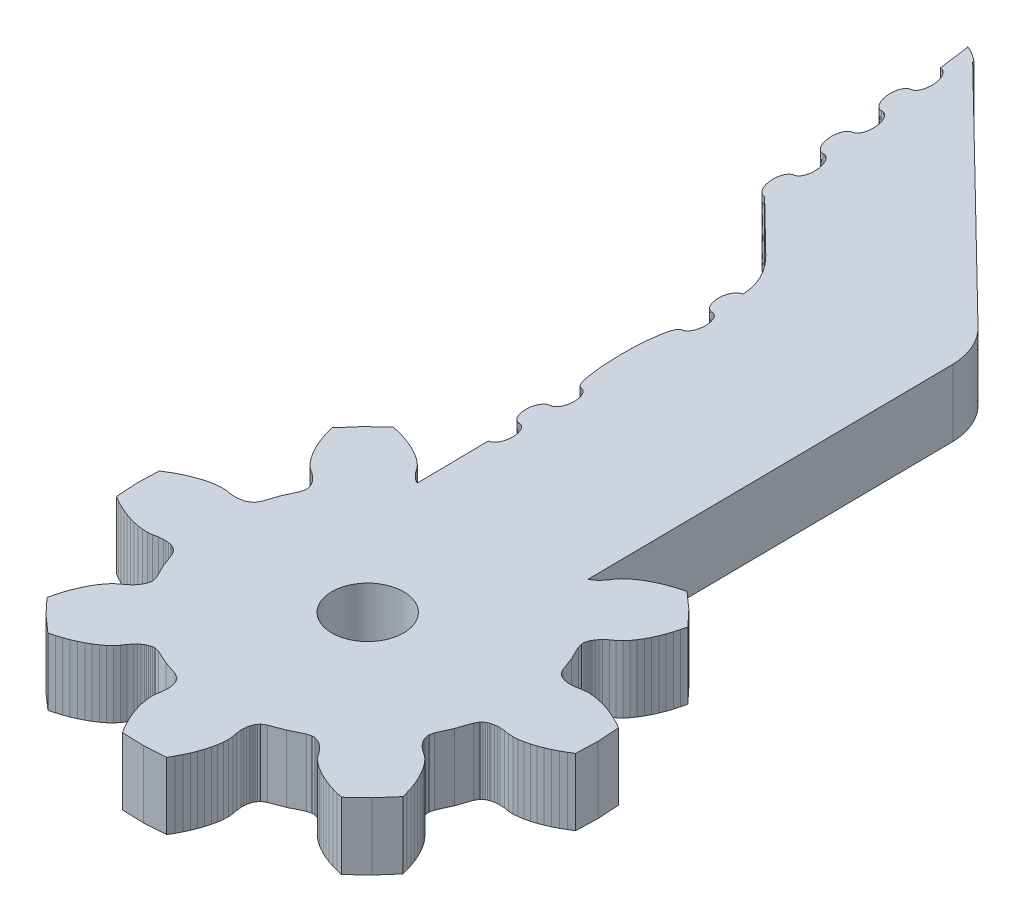
from build123d import *

# Parameters (mm, degrees)
SKETCH1_R           = 1.7
BOSS_EXTRUDE1_DEPTH = 3.175


with BuildPart() as part:
    # Sketch1 → Boss-Extrude1 (new body)
    with BuildSketch(Plane(origin=(0, 0, 0), x_dir=(1, 0, 0), z_dir=(0, 1, 0))):
        with BuildLine():
            Line((-18.239776135, 12.660233322), (-18.20571439, 12.693829395))
            Line((-18.20571439, 12.693829395), (-18.249739244, 16.070576596))
            add(Edge.make_bspline(
                [(-18.249739244, 16.070576596), (-18.022108524, 16.07365298), (-17.837527794, 16.403148424), (-17.837527794, 16.805920419)],
                knots=[2, 2, 2, 2, 3, 3, 3, 3], degree=3))
            add(Edge.make_bspline(
                [(-17.837527794, 16.805920419), (-17.837527794, 17.209024469), (-18.022108524, 17.533080083), (-18.249739243, 17.529818139)],
                knots=[3, 3, 3, 3, 4, 4, 4, 4], degree=3))
            add(Edge.make_bspline(
                [(-18.249739243, 17.529818139), (-18.477564936, 17.526741754), (-18.662067677, 17.850797368), (-18.662067677, 18.253706092)],
                knots=[4, 4, 4, 4, 5, 5, 5, 5], degree=3))
            add(Edge.make_bspline(
                [(-18.662067677, 18.253706092), (-18.662067677, 18.656673414), (-18.477564936, 18.985983297), (-18.249739243, 18.989245242)],
                knots=[5, 5, 5, 5, 6, 6, 6, 6], degree=3))
            add(Edge.make_bspline(
                [(-18.249739243, 18.989245242), (-18.022108524, 18.992507186), (-17.837527794, 19.321621744), (-17.837527794, 19.724784391)],
                knots=[6, 6, 6, 6, 7, 7, 7, 7], degree=3))
            add(Edge.make_bspline(
                [(-17.837527794, 19.724784391), (-17.837527794, 20.127566153), (-18.022108524, 20.451748729), (-18.249739243, 20.448672345)],
                knots=[7, 7, 7, 7, 8, 8, 8, 8], degree=3))
            add(Edge.make_bspline(
                [(-18.249739243, 20.448672345), (-18.477564936, 20.438300533), (-18.662067677, 21.495336527), (-18.662067677, 22.80941178)],
                knots=[8, 8, 8, 8, 9, 9, 9, 9], degree=3))
            add(Edge.make_bspline(
                [(-18.662067677, 22.80941178), (-18.662067677, 24.12368236), (-18.477564936, 25.197418727), (-18.249739243, 25.2079175)],
                knots=[9, 9, 9, 9, 10, 10, 10, 10], degree=3))
            add(Edge.make_bspline(
                [(-18.249739243, 25.2079175), (-18.022303496, 25.211179444), (-17.837722766, 25.540284235), (-17.837722766, 25.943446883)],
                knots=[10, 10, 10, 10, 11, 11, 11, 11], degree=3))
            add(Edge.make_bspline(
                [(-17.837722766, 25.943446883), (-17.837722766, 26.346423971), (-18.022303496, 26.670411221), (-18.249934216, 26.667149276)],
                knots=[11, 11, 11, 11, 12, 12, 12, 12], degree=3))
            add(Edge.make_bspline(
                [(-18.249934216, 26.667149276), (-18.477564936, 26.664082658), (-18.662067676, 26.988128506), (-18.662067676, 27.391105594)],
                knots=[12, 12, 12, 12, 13, 13, 13, 13], degree=3))
            add(Edge.make_bspline(
                [(-18.662067676, 27.391105594), (-18.662067676, 27.794004551), (-18.477564935, 28.123324201), (-18.249934216, 28.126390819)],
                knots=[13, 13, 13, 13, 14, 14, 14, 14], degree=3))
            add(Edge.make_bspline(
                [(-18.249934216, 28.126390819), (-18.259897325, 28.922148977), (-18.698488591, 29.681244444), (-19.266970724, 30.237005535)],
                knots=[14, 14, 14, 14, 15, 15, 15, 15], degree=3))
            Line((-19.266970724, 30.237005535), (-21.741565237, 32.654887595))
            add(Edge.make_bspline(
                [(-21.741565237, 32.654887595), (-21.968123606, 32.631663332), (-22.19300521, 32.964811372), (-22.244127073, 33.399138284)],
                knots=[16, 16, 16, 16, 17, 17, 17, 17], degree=3))
            add(Edge.make_bspline(
                [(-22.244127073, 33.399138284), (-22.295170946, 33.833465196), (-22.15282132, 34.20411583), (-21.926282448, 34.227359625)],
                knots=[17, 17, 17, 17, 18, 18, 18, 18], degree=3))
            add(Edge.make_bspline(
                [(-21.926282448, 34.227359625), (-21.699724078, 34.250779213), (-21.557374452, 34.621625173), (-21.608437823, 35.055756759)],
                knots=[18, 18, 18, 18, 19, 19, 19, 19], degree=3))
            add(Edge.make_bspline(
                [(-21.608437823, 35.055756759), (-21.659540189, 35.490103204), (-21.884421792, 35.823231711), (-22.110980162, 35.800007448)],
                knots=[19, 19, 19, 19, 20, 20, 20, 20], degree=3))
            add(Edge.make_bspline(
                [(-22.110980162, 35.800007448), (-22.33740205, 35.776958979), (-22.562478626, 36.110048421), (-22.613405516, 36.544375334)],
                knots=[20, 20, 20, 20, 21, 21, 21, 21], degree=3))
            add(Edge.make_bspline(
                [(-22.613405516, 36.544375334), (-22.66444939, 36.97858505), (-22.522294736, 37.349548205), (-22.295560891, 37.372792)],
                knots=[21, 21, 21, 21, 22, 22, 22, 22], degree=3))
            add(Edge.make_bspline(
                [(-22.295560891, 37.372792), (-22.069197495, 37.396016263), (-21.926789377, 37.766862222), (-21.977891742, 38.201013341)],
                knots=[22, 22, 22, 22, 23, 23, 23, 23], degree=3))
            add(Edge.make_bspline(
                [(-21.977891742, 38.201013341), (-22.028955113, 38.635398851), (-22.253895209, 38.968664086), (-22.480453578, 38.945244498)],
                knots=[23, 23, 23, 23, 24, 24, 24, 24], degree=3))
            add(Edge.make_bspline(
                [(-22.480453578, 38.945244498), (-22.706797477, 38.922215561), (-22.931952043, 39.255344069), (-22.982800943, 39.689690513)],
                knots=[24, 24, 24, 24, 25, 25, 25, 25], degree=3))
            add(Edge.make_bspline(
                [(-22.982800943, 39.689690513), (-23.033922806, 40.124017425), (-22.891690164, 40.494668059), (-22.664956319, 40.517892321)],
                knots=[25, 25, 25, 25, 26, 26, 26, 26], degree=3))
            add(Edge.make_bspline(
                [(-22.664956319, 40.517892321), (-22.438592922, 40.541331442), (-22.296262793, 40.912177402), (-22.347170186, 41.346308988)],
                knots=[26, 26, 26, 26, 27, 27, 27, 27], degree=3))
            add(Edge.make_bspline(
                [(-22.347170186, 41.346308988), (-22.398409032, 41.7806359), (-22.623173652, 42.113725342), (-22.849907497, 42.090559677)],
                knots=[27, 27, 27, 27, 28, 28, 28, 28], degree=3))
            Line((-22.849907497, 42.090559677), (-23.051996783, 43.595097322))
            Line((-23.051996783, 43.595097322), (-23.077733189, 43.592030703))
            add(Edge.make_bspline(
                [(-23.077733189, 43.592030703), (-23.078630064, 43.658988459), (-22.543819731, 43.375062573), (-22.305835957, 43.142273037)],
                knots=[30, 30, 30, 30, 31, 31, 31, 31], degree=3))
            Line((-22.305835957, 43.142273037), (-22.321102325, 43.099066924))
            Line((-22.321102325, 43.099066924), (-11.306641593, 32.336662461))
            Line((-11.306641593, 32.336662461), (-11.305237789, 32.333205191))
            add(Edge.make_bspline(
                [(-11.305237789, 32.333205191), (-10.733499611, 31.780784174), (-10.404015111, 31.023681033), (-10.389704109, 30.228098669)],
                knots=[34, 34, 34, 34, 35, 35, 35, 35], degree=3))
            Line((-10.389704109, 30.228098669), (-10.207755513, 12.741899125))
            Line((-10.207755513, 12.741899125), (-10.19810436, 12.756431381))
            Line((-10.19810436, 12.756431381), (-10.139846494, 12.787790971))
            Line((-10.139846494, 12.787790971), (-10.034931641, 12.857620019))
            Line((-10.034931641, 12.857620019), (-9.941851636, 12.934363608))
            Line((-9.941851636, 12.934363608), (-9.858032839, 13.016410298))
            Line((-9.858032839, 13.016410298), (-9.71133532, 13.193453792))
            Line((-9.71133532, 13.193453792), (-9.587254643, 13.384697486))
            Line((-9.587254643, 13.384697486), (-9.441843944, 13.562502752))
            Line((-9.441843944, 13.562502752), (-9.267050848, 13.721419992))
            Line((-9.267050848, 13.721419992), (-9.074242266, 13.867992629))
            Line((-9.074242266, 13.867992629), (-8.866147819, 14.003744204))
            Line((-8.866147819, 14.003744204), (-8.644463769, 14.128743084))
            Line((-8.644463769, 14.128743084), (-8.410632915, 14.243760804))
            Line((-8.410632915, 14.243760804), (-8.165415651, 14.348279751))
            Line((-8.165415651, 14.348279751), (-7.909747845, 14.442817539))
            Line((-7.909747845, 14.442817539), (-7.643843969, 14.52660263))
            Line((-7.643843969, 14.52660263), (-7.36879587, 14.600074508))
            Line((-7.36879587, 14.600074508), (-6.594402985, 13.917214783))
            Line((-6.594402985, 13.917214783), (-5.888815995, 13.163373586))
            Line((-5.888815995, 13.163373586), (-5.953273996, 12.885395377))
            Line((-5.953273996, 12.885395377), (-6.028786953, 12.61670492))
            Line((-6.028786953, 12.61670492), (-6.114984419, 12.357614736))
            Line((-6.114984419, 12.357614736), (-6.211710414, 12.108896364))
            Line((-6.211710414, 12.108896364), (-6.318906448, 11.87105765))
            Line((-6.318906448, 11.87105765), (-6.436845483, 11.645309616))
            Line((-6.436845483, 11.645309616), (-6.565586009, 11.432687489))
            Line((-6.565586009, 11.432687489), (-6.70575194, 11.234919906))
            Line((-6.70575194, 11.234919906), (-6.858961549, 11.054936755))
            Line((-6.858961549, 11.054936755), (-7.031590448, 10.903627463))
            Line((-7.031590448, 10.903627463), (-7.218471857, 10.773384081))
            Line((-7.218471857, 10.773384081), (-7.390515837, 10.620980963))
            Line((-7.390515837, 10.620980963), (-7.469986742, 10.534451541))
            Line((-7.469986742, 10.534451541), (-7.543530474, 10.438829694))
            Line((-7.543530474, 10.438829694), (-7.609840717, 10.331625014))
            Line((-7.609840717, 10.331625014), (-7.639496076, 10.272284973))
            Line((-7.639496076, 10.272284973), (-7.665934385, 10.207514868))
            Line((-7.665934385, 10.207514868), (-7.688434244, 10.135634897))
            Line((-7.688434244, 10.135634897), (-7.704519498, 10.052943632))
            Line((-7.704519498, 10.052943632), (-7.709257337, 9.950026358))
            Line((-7.709257337, 9.950026358), (-7.649459185, 9.730362729))
            Line((-7.649459185, 9.730362729), (-7.339082018, 9.096783756))
            Line((-7.339082018, 9.096783756), (-7.090628206, 8.436581847))
            Line((-7.090628206, 8.436581847), (-6.971597324, 8.242457094))
            Line((-6.971597324, 8.242457094), (-6.893393742, 8.175499338))
            Line((-6.893393742, 8.175499338), (-6.822228678, 8.130632954))
            Line((-6.822228678, 8.130632954), (-6.754631615, 8.097798652))
            Line((-6.754631615, 8.097798652), (-6.689471713, 8.072777391))
            Line((-6.689471713, 8.072777391), (-6.625891089, 8.053899132))
            Line((-6.625891089, 8.053899132), (-6.502395331, 8.028868104))
            Line((-6.502395331, 8.028868104), (-6.382487072, 8.017285272))
            Line((-6.382487072, 8.017285272), (-6.265308432, 8.01581056))
            Line((-6.265308432, 8.01581056), (-6.036585864, 8.037257356))
            Line((-6.036585864, 8.037257356), (-5.813809967, 8.084555549))
            Line((-5.813809967, 8.084555549), (-5.585652821, 8.107086404))
            Line((-5.585652821, 8.107086404), (-5.349852741, 8.095816093))
            Line((-5.349852741, 8.095816093), (-5.109880245, 8.062796231))
            Line((-5.109880245, 8.062796231), (-4.867041648, 8.011073904))
            Line((-4.867041648, 8.011073904), (-4.622019357, 7.942719568))
            Line((-4.622019357, 7.942719568), (-4.37567125, 7.858358265))
            Line((-4.37567125, 7.858358265), (-4.128289788, 7.758575973))
            Line((-4.128289788, 7.758575973), (-3.880927823, 7.644271193))
            Line((-3.880927823, 7.644271193), (-3.633741334, 7.515238832))
            Line((-3.633741334, 7.515238832), (-3.387256746, 7.372309026))
            Line((-3.387256746, 7.372309026), (-3.321706898, 6.340880272))
            Line((-3.321706898, 6.340880272), (-3.354988751, 5.307976808))
            Line((-3.354988751, 5.307976808), (-3.596813489, 5.157185129))
            Line((-3.596813489, 5.157185129), (-3.839847059, 5.020593651))
            Line((-3.839847059, 5.020593651), (-4.08358253, 4.898280505))
            Line((-4.08358253, 4.898280505), (-4.327493477, 4.791075825))
            Line((-4.327493477, 4.791075825), (-4.571111964, 4.698911248))
            Line((-4.571111964, 4.698911248), (-4.813950561, 4.622743871))
            Line((-4.813950561, 4.622743871), (-5.054995408, 4.563540558))
            Line((-5.054995408, 4.563540558), (-5.293681084, 4.52296158))
            Line((-5.293681084, 4.52296158), (-5.529110715, 4.504278647))
            Line((-5.529110715, 4.504278647), (-5.758028255, 4.519699636))
            Line((-5.758028255, 4.519699636), (-5.982090973, 4.559956326))
            Line((-5.982090973, 4.559956326), (-6.211320469, 4.574097929))
            Line((-6.211320469, 4.574097929), (-6.328499109, 4.569048752))
            Line((-6.328499109, 4.569048752), (-6.447841948, 4.553617997))
            Line((-6.447841948, 4.553617997), (-6.570499323, 4.524758579))
            Line((-6.570499323, 4.524758579), (-6.633495028, 4.503887995))
            Line((-6.633495028, 4.503887995), (-6.697953029, 4.476884175))
            Line((-6.697953029, 4.476884175), (-6.764399752, 4.441803624))
            Line((-6.764399752, 4.441803624), (-6.834355985, 4.394632393))
            Line((-6.834355985, 4.394632393), (-6.910200396, 4.325379556))
            Line((-6.910200396, 4.325379556), (-7.023031143, 4.127797533))
            Line((-7.023031143, 4.127797533), (-7.250661863, 3.459909546))
            Line((-7.250661863, 3.459909546), (-7.541171304, 2.816925626))
            Line((-7.541171304, 2.816925626), (-7.593872446, 2.5954064))
            Line((-7.593872446, 2.5954064), (-7.585878562, 2.49274305))
            Line((-7.585878562, 2.49274305), (-7.567102684, 2.410559632))
            Line((-7.567102684, 2.410559632), (-7.5426336, 2.339451198))
            Line((-7.5426336, 2.339451198), (-7.514011596, 2.275579593))
            Line((-7.514011596, 2.275579593), (-7.482698968, 2.217138052))
            Line((-7.482698968, 2.217138052), (-7.412937707, 2.112111257))
            Line((-7.412937707, 2.112111257), (-7.336332902, 2.018852854))
            Line((-7.336332902, 2.018852854), (-7.254502827, 1.934813839))
            Line((-7.254502827, 1.934813839), (-7.077584527, 1.787860317))
            Line((-7.077584527, 1.787860317), (-6.886686679, 1.663632976))
            Line((-6.886686679, 1.663632976), (-6.709202958, 1.517695148))
            Line((-6.709202958, 1.517695148), (-6.550768078, 1.342839306))
            Line((-6.550768078, 1.342839306), (-6.404402013, 1.149417726))
            Line((-6.404402013, 1.149417726), (-6.268954423, 0.940956044))
            Line((-6.268954423, 0.940956044), (-6.144171844, 0.719055932))
            Line((-6.144171844, 0.719055932), (-6.029371872, 0.484860048))
            Line((-6.029371872, 0.484860048), (-5.924846965, 0.239208293))
            Line((-5.924846965, 0.239208293), (-5.830675113, -0.017000832))
            Line((-5.830675113, -0.017000832), (-5.746856315, -0.283318078))
            Line((-5.746856315, -0.283318078), (-5.673644036, -0.558923075))
            Line((-5.673644036, -0.558923075), (-6.355132391, -1.334718915))
            Line((-6.355132391, -1.334718915), (-7.107805308, -2.041584207))
            Line((-7.107805308, -2.041584207), (-7.385076097, -1.976941064))
            Line((-7.385076097, -1.976941064), (-7.653475625, -1.901291301))
            Line((-7.653475625, -1.901291301), (-7.912107017, -1.815142765))
            Line((-7.912107017, -1.815142765), (-8.160365857, -1.718046207))
            Line((-8.160365857, -1.718046207), (-8.397589237, -1.610646201))
            Line((-8.397589237, -1.610646201), (-8.623055759, -1.492552096))
            Line((-8.623055759, -1.492552096), (-8.835361618, -1.363588099))
            Line((-8.835361618, -1.363588099), (-9.032713065, -1.223158466))
            Line((-9.032713065, -1.223158466), (-9.212360984, -1.069808016))
            Line((-9.212360984, -1.069808016), (-9.363406396, -0.896739407))
            Line((-9.363406396, -0.896739407), (-9.493277764, -0.709529194))
            Line((-9.493277764, -0.709529194), (-9.645395526, -0.537163758))
            Line((-9.645395526, -0.537163758), (-9.73196344, -0.457666073))
            Line((-9.73196344, -0.457666073), (-9.82722714, -0.383998869))
            Line((-9.82722714, -0.383998869), (-9.934442671, -0.317431765))
            Line((-9.934442671, -0.317431765), (-9.993655905, -0.287673848))
            Line((-9.993655905, -0.287673848), (-10.058308878, -0.261177874))
            Line((-10.058308878, -0.261177874), (-10.130000369, -0.238900943))
            Line((-10.130000369, -0.238900943), (-10.212610336, -0.222708417))
            Line((-10.212610336, -0.222708417), (-10.31514652, -0.2178448))
            Line((-10.31514652, -0.2178448), (-10.534412908, -0.277692688))
            Line((-10.534412908, -0.277692688), (-11.166846111, -0.588876319))
            Line((-11.166846111, -0.588876319), (-11.826049078, -0.837594691))
            Line((-11.826049078, -0.837594691), (-12.019832523, -0.956772855))
            Line((-12.019832523, -0.956772855), (-12.086649694, -1.035176715))
            Line((-12.086649694, -1.035176715), (-12.13137645, -1.106480474))
            Line((-12.13137645, -1.106480474), (-12.164151374, -1.174131637))
            Line((-12.164151374, -1.174131637), (-12.189010404, -1.23948772))
            Line((-12.189010404, -1.23948772), (-12.207981255, -1.303163998))
            Line((-12.207981255, -1.303163998), (-12.232957268, -1.426883492))
            Line((-12.232957268, -1.426883492), (-12.244577646, -1.546960156))
            Line((-12.244577646, -1.546960156), (-12.246000947, -1.66434132))
            Line((-12.246000947, -1.66434132), (-12.224651428, -1.893673587))
            Line((-12.224651428, -1.893673587), (-12.177370529, -2.116667524))
            Line((-12.177370529, -2.116667524), (-12.154753686, -2.345482177))
            Line((-12.154753686, -2.345482177), (-12.166140097, -2.58166062))
            Line((-12.166140097, -2.58166062), (-12.199090496, -2.821862778))
            Line((-12.199090496, -2.821862778), (-12.250524315, -3.065209686))
            Line((-12.250524315, -3.065209686), (-12.319018253, -3.310666114))
            Line((-12.319018253, -3.310666114), (-12.403226996, -3.557401928))
            Line((-12.403226996, -3.557401928), (-12.502624119, -3.805231567))
            Line((-12.502624119, -3.805231567), (-12.616936659, -4.053246767))
            Line((-12.616936659, -4.053246767), (-12.745482213, -4.300754118))
            Line((-12.745482213, -4.300754118), (-12.88839726, -4.547675491))
            Line((-12.88839726, -4.547675491), (-13.91795102, -4.613344095))
            Line((-13.91795102, -4.613344095), (-14.948986574, -4.580128908))
            Line((-14.948986574, -4.580128908), (-15.099447068, -4.337934424))
            Line((-15.099447068, -4.337934424), (-15.235850024, -4.094460554))
            Line((-15.235850024, -4.094460554), (-15.357688514, -3.850224913))
            Line((-15.357688514, -3.850224913), (-15.464904045, -3.605666985))
            Line((-15.464904045, -3.605666985), (-15.556892202, -3.361616903))
            Line((-15.556892202, -3.361616903), (-15.632795105, -3.11852392))
            Line((-15.632795105, -3.11852392), (-15.692027835, -2.87684705))
            Line((-15.692027835, -2.87684705), (-15.732387201, -2.637719184))
            Line((-15.732387201, -2.637719184), (-15.751046096, -2.402058355))
            Line((-15.751046096, -2.402058355), (-15.735838219, -2.172735855))
            Line((-15.735838219, -2.172735855), (-15.695478853, -1.94833557))
            Line((-15.695478853, -1.94833557), (-15.6815383, -1.718427092))
            Line((-15.6815383, -1.718427092), (-15.686588095, -1.601045927))
            Line((-15.686588095, -1.601045927), (-15.701990944, -1.481486878))
            Line((-15.701990944, -1.481486878), (-15.730612948, -1.358656117))
            Line((-15.730612948, -1.358656117), (-15.751631014, -1.29555605))
            Line((-15.751631014, -1.29555605), (-15.778595749, -1.231098468))
            Line((-15.778595749, -1.231098468), (-15.813534871, -1.164345804))
            Line((-15.813534871, -1.164345804), (-15.860425825, -1.094516756))
            Line((-15.860425825, -1.094516756), (-15.929621664, -1.018281015))
            Line((-15.929621664, -1.018281015), (-16.127031603, -0.90544118))
            Line((-16.127031603, -0.90544118), (-16.793643535, -0.677202739))
            Line((-16.793643535, -0.677202739), (-17.435474427, -0.386176753))
            Line((-17.435474427, -0.386176753), (-17.656593055, -0.333370367))
            Line((-17.656593055, -0.333370367), (-17.75912924, -0.341368967))
            Line((-17.75912924, -0.341368967), (-17.840978813, -0.360061666))
            Line((-17.840978813, -0.360061666), (-17.912143877, -0.384897368))
            Line((-17.912143877, -0.384897368), (-17.9757245, -0.413444264))
            Line((-17.9757245, -0.413444264), (-18.034235831, -0.444999181))
            Line((-18.034235831, -0.444999181), (-18.139092192, -0.514828229))
            Line((-18.139092192, -0.514828229), (-18.231977224, -0.591376491))
            Line((-18.231977224, -0.591376491), (-18.315990995, -0.673559909))
            Line((-18.315990995, -0.673559909), (-18.462688514, -0.850652235))
            Line((-18.462688514, -0.850652235), (-18.586749693, -1.041905696))
            Line((-18.586749693, -1.041905696), (-18.732160392, -1.219515635))
            Line((-18.732160392, -1.219515635), (-18.906953488, -1.378628201))
            Line((-18.906953488, -1.378628201), (-19.099840059, -1.525005512))
            Line((-19.099840059, -1.525005512), (-19.307934506, -1.660757088))
            Line((-19.307934506, -1.660757088), (-19.529560064, -1.785951293))
            Line((-19.529560064, -1.785951293), (-19.763390918, -1.900773687))
            Line((-19.763390918, -1.900773687), (-20.008393713, -2.00548796))
            Line((-20.008393713, -2.00548796), (-20.264275988, -2.099830422))
            Line((-20.264275988, -2.099830422), (-20.530179864, -2.183801073))
            Line((-20.530179864, -2.183801073), (-20.805286456, -2.257282717))
            Line((-20.805286456, -2.257282717), (-21.579620848, -1.574354628))
            Line((-21.579620848, -1.574354628), (-22.285207839, -0.820513431))
            Line((-22.285207839, -0.820513431), (-22.220730341, -0.542603587))
            Line((-22.220730341, -0.542603587), (-22.145217383, -0.273717804))
            Line((-22.145217383, -0.273717804), (-22.059039415, -0.014822946))
            Line((-22.059039415, -0.014822946), (-21.962313419, 0.234090753))
            Line((-21.962313419, 0.234090753), (-21.855097888, 0.471802505))
            Line((-21.855097888, 0.471802505), (-21.737236843, 0.697677501))
            Line((-21.737236843, 0.697677501), (-21.608437825, 0.910299627))
            Line((-21.608437825, 0.910299627), (-21.468252396, 1.108067211))
            Line((-21.468252396, 1.108067211), (-21.315237759, 1.288050361))
            Line((-21.315237759, 1.288050361), (-21.142296904, 1.439164327))
            Line((-21.142296904, 1.439164327), (-20.955551976, 1.569417476))
            Line((-20.955551976, 1.569417476), (-20.783371515, 1.721810828))
            Line((-20.783371515, 1.721810828), (-20.704212567, 1.808535576))
            Line((-20.704212567, 1.808535576), (-20.630493359, 1.903962097))
            Line((-20.630493359, 1.903962097), (-20.564241609, 2.011235141))
            Line((-20.564241609, 2.011235141), (-20.534527757, 2.070565416))
            Line((-20.534527757, 2.070565416), (-20.508069951, 2.135345286))
            Line((-20.508069951, 2.135345286), (-20.485589589, 2.207156893))
            Line((-20.485589589, 2.207156893), (-20.469484838, 2.289916523))
            Line((-20.469484838, 2.289916523), (-20.464766497, 2.392765433))
            Line((-20.464766497, 2.392765433), (-20.524564648, 2.612497426))
            Line((-20.524564648, 2.612497426), (-20.834922318, 3.246008035))
            Line((-20.834922318, 3.246008035), (-21.083454119, 3.906405269))
            Line((-21.083454119, 3.906405269), (-21.202426509, 4.100530023))
            Line((-21.202426509, 4.100530023), (-21.28049361, 4.16735105))
            Line((-21.28049361, 4.16735105), (-21.351658674, 4.212158836))
            Line((-21.351658674, 4.212158836), (-21.419197245, 4.245188464))
            Line((-21.419197245, 4.245188464), (-21.484552121, 4.2700144))
            Line((-21.484552121, 4.2700144), (-21.548113247, 4.289087985))
            Line((-21.548113247, 4.289087985), (-21.671492021, 4.313923687))
            Line((-21.671492021, 4.313923687), (-21.791341789, 4.325701845))
            Line((-21.791341789, 4.325701845), (-21.908715402, 4.327176556))
            Line((-21.908715402, 4.327176556), (-22.137437969, 4.305729761))
            Line((-22.137437969, 4.305729761), (-22.360213867, 4.258431568))
            Line((-22.360213867, 4.258431568), (-22.588546488, 4.235715153))
            Line((-22.588546488, 4.235715153), (-22.824171092, 4.247171023))
            Line((-22.824171092, 4.247171023), (-23.064143588, 4.280190885))
            Line((-23.064143588, 4.280190885), (-23.306982185, 4.331717886))
            Line((-23.306982185, 4.331717886), (-23.552043471, 4.400267549))
            Line((-23.552043471, 4.400267549), (-23.798333086, 4.484628852))
            Line((-23.798333086, 4.484628852), (-24.045714548, 4.584284181))
            Line((-24.045714548, 4.584284181), (-24.29309601, 4.698715923))
            Line((-24.29309601, 4.698715923), (-24.5402825, 4.827562725))
            Line((-24.5402825, 4.827562725), (-24.786767087, 4.970678091))
            Line((-24.786767087, 4.970678091), (-24.852316935, 6.001979882))
            Line((-24.852316935, 6.001979882), (-24.819035082, 7.035010309))
            Line((-24.819035082, 7.035010309), (-24.577268836, 7.185801987))
            Line((-24.577268836, 7.185801987), (-24.334371747, 7.322393465))
            Line((-24.334371747, 7.322393465), (-24.090441303, 7.444511285))
            Line((-24.090441303, 7.444511285), (-23.846510859, 7.551911291))
            Line((-23.846510859, 7.551911291), (-23.602716896, 7.644075868))
            Line((-23.602716896, 7.644075868), (-23.360073273, 7.720116283))
            Line((-23.360073273, 7.720116283), (-23.119008928, 7.779446558))
            Line((-23.119008928, 7.779446558), (-22.880323252, 7.819898575))
            Line((-22.880323252, 7.819898575), (-22.644893621, 7.838581507))
            Line((-22.644893621, 7.838581507), (-22.415976081, 7.823355845))
            Line((-22.415976081, 7.823355845), (-22.191932861, 7.782835464))
            Line((-22.191932861, 7.782835464), (-21.962683867, 7.768693861))
            Line((-21.962683867, 7.768693861), (-21.845524724, 7.773811403))
            Line((-21.845524724, 7.773811403), (-21.725986913, 7.789232391))
            Line((-21.725986913, 7.789232391), (-21.603388029, 7.818042977))
            Line((-21.603388029, 7.818042977), (-21.540509308, 7.839099121))
            Line((-21.540509308, 7.839099121), (-21.476051307, 7.866171306))
            Line((-21.476051307, 7.866171306), (-21.409604584, 7.901183493))
            Line((-21.409604584, 7.901183493), (-21.339843324, 7.948159398))
            Line((-21.339843324, 7.948159398), (-21.263823437, 8.017480598))
            Line((-21.263823437, 8.017480598), (-21.15099269, 8.215189584))
            Line((-21.15099269, 8.215189584), (-20.923342473, 8.88307757))
            Line((-20.923342473, 8.88307757), (-20.632852529, 9.526061491))
            Line((-20.632852529, 9.526061491), (-20.580151387, 9.747580717))
            Line((-20.580151387, 9.747580717), (-20.588125774, 9.850048741))
            Line((-20.588125774, 9.850048741), (-20.606784669, 9.932232159))
            Line((-20.606784669, 9.932232159), (-20.631390233, 10.003408956))
            Line((-20.631390233, 10.003408956), (-20.660012237, 10.067221963))
            Line((-20.660012237, 10.067221963), (-20.691500341, 10.125849065))
            Line((-20.691500341, 10.125849065), (-20.761066629, 10.230875859))
            Line((-20.761066629, 10.230875859), (-20.837671434, 10.323938936))
            Line((-20.837671434, 10.323938936), (-20.919521006, 10.408173277))
            Line((-20.919521006, 10.408173277), (-21.096497798, 10.5551268))
            Line((-21.096497798, 10.5551268), (-21.287317657, 10.679227179))
            Line((-21.287317657, 10.679227179), (-21.464625902, 10.825096642))
            Line((-21.464625902, 10.825096642), (-21.623450728, 10.999952485))
            Line((-21.623450728, 10.999952485), (-21.769621821, 11.193374065))
            Line((-21.769621821, 11.193374065), (-21.905069411, 11.401835747))
            Line((-21.905069411, 11.401835747), (-22.029832492, 11.623745625))
            Line((-22.029832492, 11.623745625), (-22.144515481, 11.858127069))
            Line((-22.144515481, 11.858127069), (-22.249176868, 12.103651861))
            Line((-22.249176868, 12.103651861), (-22.343348721, 12.359987948))
            Line((-22.343348721, 12.359987948), (-22.42722601, 12.626119635))
            Line((-22.42722601, 12.626119635), (-22.50057477, 12.901910192))
            Line((-22.50057477, 12.901910192), (-21.818696469, 13.677706032))
            Line((-21.818696469, 13.677706032), (-21.066199028, 14.384571323))
            Line((-21.066199028, 14.384571323), (-20.788928239, 14.319996545))
            Line((-20.788928239, 14.319996545), (-20.520528711, 14.244337016))
            Line((-20.520528711, 14.244337016), (-20.261975308, 14.157934556))
            Line((-20.261975308, 14.157934556), (-20.01363848, 14.061091921))
            Line((-20.01363848, 14.061091921), (-19.776239624, 13.953633318))
            Line((-19.776239624, 13.953633318), (-19.550968075, 13.835539213))
            Line((-19.550968075, 13.835539213), (-19.338720707, 13.706575216))
            Line((-19.338720707, 13.706575216), (-19.141310768, 13.566145582))
            Line((-19.141310768, 13.566145582), (-18.961643352, 13.412668171))
            Line((-18.961643352, 13.412668171), (-18.810617438, 13.239726523))
            Line((-18.810617438, 13.239726523), (-18.680531599, 13.052516311))
            Line((-18.680531599, 13.052516311), (-18.528413837, 12.879955549))
            Line((-18.528413837, 12.879955549), (-18.442040896, 12.800467629))
            Line((-18.442040896, 12.800467629), (-18.346777196, 12.726859023))
            Line((-18.346777196, 12.726859023), (-18.239776135, 12.660233322))
        make_face()
        with Locations(Location((-14.074328937, 6.171493558, 0), (0, 0, 270))):
            Circle(SKETCH1_R, mode=Mode.SUBTRACT)
    extrude(amount=BOSS_EXTRUDE1_DEPTH)


solid = part.part
